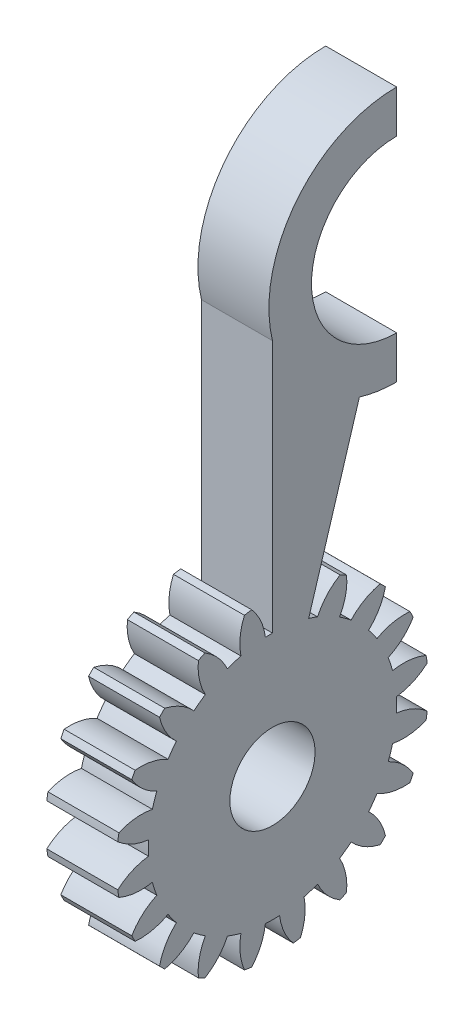
from build123d import *

# Parameters (mm, degrees)
SKETCH_2_R      = 3
EXTRUDE_2_DEPTH = 5


with BuildPart() as part:
    # ｽｹｯﾁ2 → ﾎﾞｽ - 押し出し2 (new body)
    with BuildSketch(Plane(origin=(-4.158413815, 0, 0), x_dir=(0, 0, -1), z_dir=(1, 0, 0))):
        with BuildLine():
            Line((8.749, 22.67838595), (8.749, 25.67838595))
            ThreePointArc((8.749, 25.67838595), (2.749, 31.67838595), (8.749, 37.67838595))
            Line((8.749, 37.67838595), (8.749, 40.67838595))
            ThreePointArc((8.749, 40.67838595), (1.678067187, 37.246321757), (0, 29.567699095))
            Line((0, 29.567699095), (0, 11.731480336))
            ThreePointArc((0, 11.731480336), (-0.250064167, 11.727905936), (-0.499924007, 11.717185654))
            ThreePointArc((-0.499924007, 11.717185654), (-0.818060825, 12.87403268), (-1.464956435, 13.884494033))
            ThreePointArc((-1.464956435, 13.884494033), (-1.720779115, 13.847052083), (-1.975651141, 13.803607938))
            ThreePointArc((-1.975651141, 13.803607938), (-2.278635697, 12.642700346), (-2.223716399, 11.444163761))
            ThreePointArc((-2.223716399, 11.444163761), (-2.703589684, 11.303273797), (-3.174628369, 11.135193732))
            ThreePointArc((-3.174628369, 11.135193732), (-3.834679853, 12.137110952), (-4.762163869, 12.898215069))
            ThreePointArc((-4.762163869, 12.898215069), (-4.993895497, 12.783552102), (-5.222868219, 12.663474478))
            ThreePointArc((-5.222868219, 12.663474478), (-5.15228348, 11.465758371), (-4.729683951, 10.342853338))
            ThreePointArc((-4.729683951, 10.342853338), (-5.142533172, 10.06057002), (-5.538577987, 9.75515742))
            ThreePointArc((-5.538577987, 9.75515742), (-6.4759337, 10.504070195), (-7.593217523, 10.941314902))
            ThreePointArc((-7.593217523, 10.941314902), (-7.778174593, 10.760654929), (-7.958834566, 10.57569786))
            ThreePointArc((-7.958834566, 10.57569786), (-7.521589858, 9.458414036), (-6.772677084, 8.521058323))
            ThreePointArc((-6.772677084, 8.521058323), (-7.078089684, 8.125013509), (-7.360373002, 7.712164287))
            ThreePointArc((-7.360373002, 7.712164287), (-8.483278035, 8.134763816), (-9.680994141, 8.205348555))
            ThreePointArc((-9.680994141, 8.205348555), (-9.801071766, 7.976375833), (-9.915734733, 7.744644205))
            ThreePointArc((-9.915734733, 7.744644205), (-9.154630615, 6.81716019), (-8.152713396, 6.157108705))
            ThreePointArc((-8.152713396, 6.157108705), (-8.320793461, 5.68607002), (-8.461683425, 5.206196735))
            ThreePointArc((-8.461683425, 5.206196735), (-9.66022001, 5.261116033), (-10.821127601, 4.958131478))
            ThreePointArc((-10.821127601, 4.958131478), (-10.864571747, 4.703259452), (-10.902013697, 4.447436771))
            ThreePointArc((-10.902013697, 4.447436771), (-9.891552344, 3.800541161), (-8.734705318, 3.482404344))
            ThreePointArc((-8.734705318, 3.482404344), (-8.749, 2.982480336), (-8.734705318, 2.482556329))
            ThreePointArc((-8.734705318, 2.482556329), (-9.891552344, 2.164419511), (-10.902013697, 1.517523901))
            ThreePointArc((-10.902013697, 1.517523901), (-10.864571747, 1.261701221), (-10.821127601, 1.006829195))
            ThreePointArc((-10.821127601, 1.006829195), (-9.66022001, 0.70384464), (-8.461683425, 0.758763937))
            ThreePointArc((-8.461683425, 0.758763937), (-8.320793461, 0.278890652), (-8.152713396, -0.192148033))
            ThreePointArc((-8.152713396, -0.192148033), (-9.154630615, -0.852199517), (-9.915734733, -1.779683533))
            ThreePointArc((-9.915734733, -1.779683533), (-9.801071766, -2.011415161), (-9.680994141, -2.240387883))
            ThreePointArc((-9.680994141, -2.240387883), (-8.483278035, -2.169803144), (-7.360373002, -1.747203615))
            ThreePointArc((-7.360373002, -1.747203615), (-7.078089684, -2.160052836), (-6.772677084, -2.556097651))
            ThreePointArc((-6.772677084, -2.556097651), (-7.521589858, -3.493453364), (-7.958834566, -4.610737187))
            ThreePointArc((-7.958834566, -4.610737187), (-7.778174593, -4.795694257), (-7.593217523, -4.976354229))
            ThreePointArc((-7.593217523, -4.976354229), (-6.4759337, -4.539109522), (-5.538577987, -3.790196748))
            ThreePointArc((-5.538577987, -3.790196748), (-5.142533172, -4.095609348), (-4.729683951, -4.377892665))
            ThreePointArc((-4.729683951, -4.377892665), (-5.15228348, -5.500797699), (-5.222868219, -6.698513805))
            ThreePointArc((-5.222868219, -6.698513805), (-4.993895497, -6.81859143), (-4.762163869, -6.933254396))
            ThreePointArc((-4.762163869, -6.933254396), (-3.834679853, -6.172150279), (-3.174628369, -5.17023306))
            ThreePointArc((-3.174628369, -5.17023306), (-2.703589684, -5.338313125), (-2.223716399, -5.479203088))
            ThreePointArc((-2.223716399, -5.479203088), (-2.278635697, -6.677739674), (-1.975651141, -7.838647265))
            ThreePointArc((-1.975651141, -7.838647265), (-1.720779115, -7.88209141), (-1.464956435, -7.91953336))
            ThreePointArc((-1.464956435, -7.91953336), (-0.818060825, -6.909072007), (-0.499924007, -5.752224981))
            ThreePointArc((-0.499924007, -5.752224981), (0, -5.766519664), (0.499924007, -5.752224981))
            ThreePointArc((0.499924007, -5.752224981), (0.818060825, -6.909072007), (1.464956435, -7.91953336))
            ThreePointArc((1.464956435, -7.91953336), (1.720779115, -7.88209141), (1.975651141, -7.838647265))
            ThreePointArc((1.975651141, -7.838647265), (2.278635697, -6.677739674), (2.223716399, -5.479203088))
            ThreePointArc((2.223716399, -5.479203088), (2.703589684, -5.338313125), (3.174628369, -5.17023306))
            ThreePointArc((3.174628369, -5.17023306), (3.834679853, -6.172150279), (4.762163869, -6.933254396))
            ThreePointArc((4.762163869, -6.933254396), (4.993895497, -6.81859143), (5.222868219, -6.698513805))
            ThreePointArc((5.222868219, -6.698513805), (5.15228348, -5.500797699), (4.729683951, -4.377892665))
            ThreePointArc((4.729683951, -4.377892665), (5.142533172, -4.095609348), (5.538577987, -3.790196748))
            ThreePointArc((5.538577987, -3.790196748), (6.4759337, -4.539109522), (7.593217523, -4.976354229))
            ThreePointArc((7.593217523, -4.976354229), (7.778174593, -4.795694257), (7.958834566, -4.610737187))
            ThreePointArc((7.958834566, -4.610737187), (7.521589858, -3.493453364), (6.772677084, -2.556097651))
            ThreePointArc((6.772677084, -2.556097651), (7.078089684, -2.160052836), (7.360373002, -1.747203615))
            ThreePointArc((7.360373002, -1.747203615), (8.483278035, -2.169803144), (9.680994141, -2.240387883))
            ThreePointArc((9.680994141, -2.240387883), (9.801071766, -2.011415161), (9.915734733, -1.779683533))
            ThreePointArc((9.915734733, -1.779683533), (9.154630615, -0.852199517), (8.152713396, -0.192148033))
            ThreePointArc((8.152713396, -0.192148033), (8.320793461, 0.278890652), (8.461683425, 0.758763937))
            ThreePointArc((8.461683425, 0.758763937), (9.66022001, 0.70384464), (10.821127601, 1.006829195))
            ThreePointArc((10.821127601, 1.006829195), (10.864571747, 1.261701221), (10.902013697, 1.517523901))
            ThreePointArc((10.902013697, 1.517523901), (9.891552344, 2.164419511), (8.734705318, 2.482556329))
            ThreePointArc((8.734705318, 2.482556329), (8.749, 2.982480336), (8.734705318, 3.482404344))
            ThreePointArc((8.734705318, 3.482404344), (9.891552344, 3.800541161), (10.902013697, 4.447436771))
            ThreePointArc((10.902013697, 4.447436771), (10.864571747, 4.703259452), (10.821127601, 4.958131478))
            ThreePointArc((10.821127601, 4.958131478), (9.66022001, 5.261116033), (8.461683425, 5.206196735))
            ThreePointArc((8.461683425, 5.206196735), (8.320793461, 5.68607002), (8.152713396, 6.157108705))
            ThreePointArc((8.152713396, 6.157108705), (9.154630615, 6.81716019), (9.915734733, 7.744644205))
            ThreePointArc((9.915734733, 7.744644205), (9.801071766, 7.976375833), (9.680994141, 8.205348555))
            ThreePointArc((9.680994141, 8.205348555), (8.483278035, 8.134763816), (7.360373002, 7.712164287))
            ThreePointArc((7.360373002, 7.712164287), (7.078089684, 8.125013509), (6.772677084, 8.521058323))
            ThreePointArc((6.772677084, 8.521058323), (7.521589858, 9.458414036), (7.958834566, 10.57569786))
            ThreePointArc((7.958834566, 10.57569786), (7.778174593, 10.760654929), (7.593217523, 10.941314902))
            ThreePointArc((7.593217523, 10.941314902), (6.4759337, 10.504070195), (5.538577987, 9.75515742))
            ThreePointArc((5.538577987, 9.75515742), (5.142533172, 10.06057002), (4.729683951, 10.342853338))
            ThreePointArc((4.729683951, 10.342853338), (5.15228348, 11.465758371), (5.222868219, 12.663474478))
            ThreePointArc((5.222868219, 12.663474478), (4.993895497, 12.783552102), (4.762163869, 12.898215069))
            ThreePointArc((4.762163869, 12.898215069), (3.834679853, 12.137110952), (3.174628369, 11.135193732))
            ThreePointArc((3.174628369, 11.135193732), (2.865099875, 11.249051796), (2.551500033, 11.351162943))
            Line((2.551500033, 11.351162943), (6.1243, 23.069614266))
            ThreePointArc((6.1243, 23.069614266), (7.422151319, 22.776730341), (8.749, 22.67838595))
        make_face()
        with Locations(Location((0, 2.982480336, 0), (0, 0, 180))):
            Circle(SKETCH_2_R, mode=Mode.SUBTRACT)
    extrude(amount=EXTRUDE_2_DEPTH)


solid = part.part
